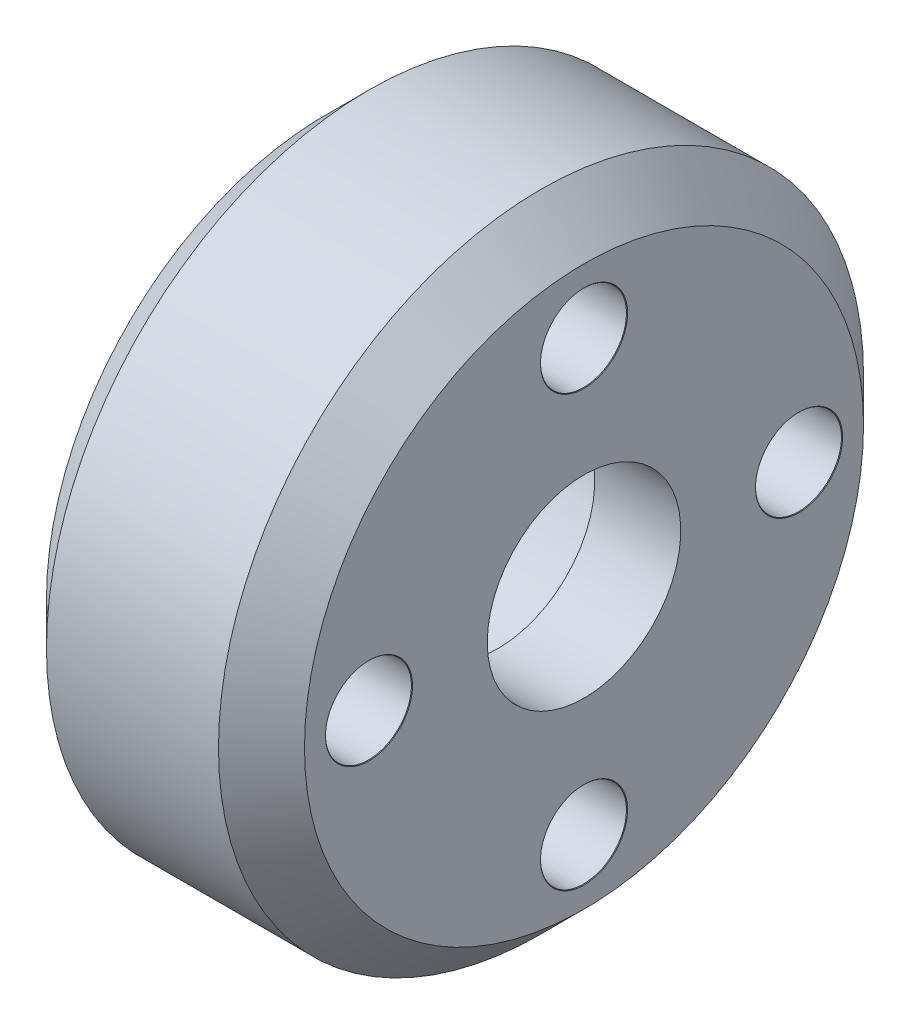
from build123d import *

# Parameters (mm, degrees)
PATTERN_CIRCULAR_2_COUNT = 4
CHAMFER_1_SIZE           = 2


with BuildPart() as part:
    # Эскиз1 → Повернуть1 (revolve)
    with BuildSketch(Plane.XY, mode=Mode.PRIVATE) as revolve_1_sk:
        Polygon((0, 7), (0, 15), (12, 15), (12, 4.5), (8, 4.5), (8, 7), align=None)
    revolve(revolve_1_sk.sketch.rotate(Axis((0, 0, 0), (1, 0, 0)), 90), axis=Axis((0, 0, 0), (1, 0, 0)))

    # Эскиз3 → Отверстия под штифты Ø4.0 мм1 (revolve, cut)
    with BuildSketch(Plane(origin=(12, 10, 0), x_dir=(0, 0, -1), z_dir=(0, 1, 0))):
        Polygon((0, 0), (0, 6.201721238), (2, 5), (2, 0.025), (2.025, 0), align=None)
    hole_wizard_4_0_1 = revolve(axis=Axis((18.35, 10, 0), (-1, 0, 0)), mode=Mode.SUBTRACT)

    # Круговой массив2: Отверстия под штифты Ø4.0 мм1 ×4 about axis
    pattern_circular_2_axis = Axis((0, 0, 0), (1, 0, 0))
    for i in range(1, PATTERN_CIRCULAR_2_COUNT):
        add(hole_wizard_4_0_1.rotate(pattern_circular_2_axis, i * 360 / PATTERN_CIRCULAR_2_COUNT), mode=Mode.SUBTRACT)

    # Фаска1
    chamfer_1_edges = [part.edges().sort_by_distance(p)[0] for p in [
        (12, 0, -15),
        (0, 0, -15),
    ]]
    chamfer(chamfer_1_edges, length=CHAMFER_1_SIZE)


solid = part.part
